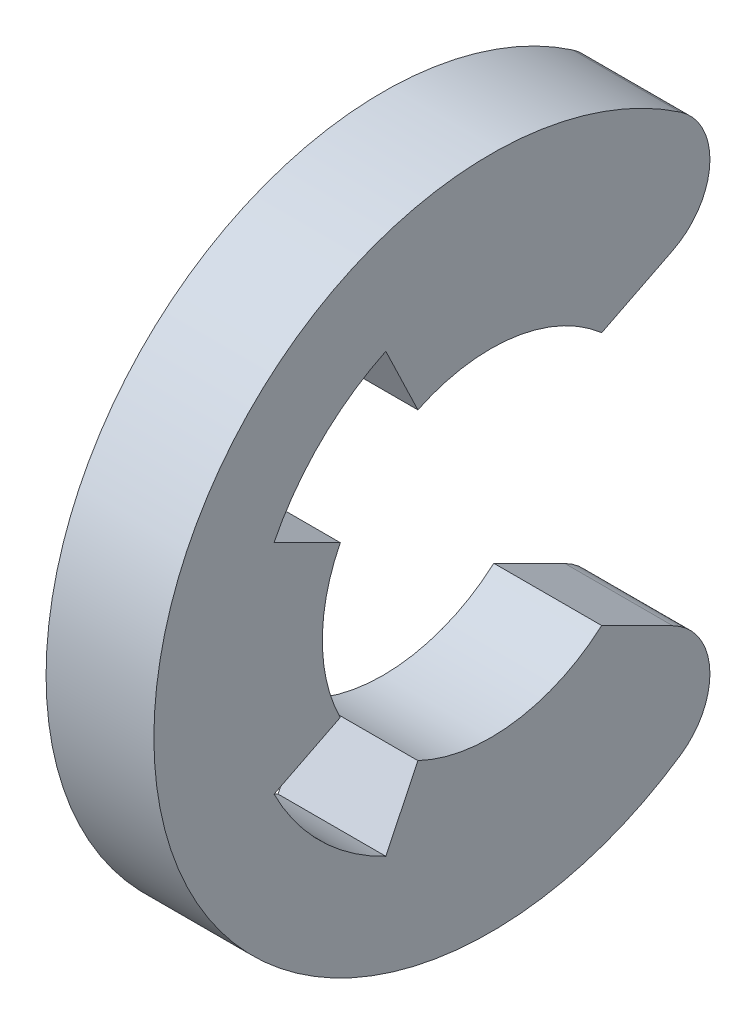
from build123d import *

# Parameters (mm, degrees)
EXTRUDE_1_DEPTH = 0.8
FILLET_1_R      = 0.5


with BuildPart() as part:
    # 草图1 → 凸台-拉伸1 (new body)
    with BuildSketch(Plane.YZ):
        with BuildLine():
            Line((-0.94087303, -0.822956828), (-1.523298061, -1.982312543))
            ThreePointArc((-1.523298061, -1.982312543), (0, 2.5), (1.523298061, -1.982312543))
            Line((1.523298061, -1.982312543), (0.94087303, -0.822956828))
            ThreePointArc((0.94087303, -0.822956828), (1.238528092, -0.16896202), (1.126927701, 0.540864084))
            Line((1.126927701, 0.540864084), (1.622775889, 0.778844281))
            ThreePointArc((1.622775889, 0.778844281), (1.284522021, 1.260953281), (0.808758974, 1.608076156))
            Line((0.808758974, 1.608076156), (0.561638176, 1.116719553))
            ThreePointArc((0.561638176, 1.116719553), (0, 1.25), (-0.561638176, 1.116719553))
            Line((-0.561638176, 1.116719553), (-0.808758974, 1.608076156))
            ThreePointArc((-0.808758974, 1.608076156), (-1.284522021, 1.260953281), (-1.622775889, 0.778844281))
            Line((-1.622775889, 0.778844281), (-1.126927701, 0.540864084))
            ThreePointArc((-1.126927701, 0.540864084), (-1.238528092, -0.16896202), (-0.94087303, -0.822956828))
        make_face()
    extrude(amount=EXTRUDE_1_DEPTH)

    # 圆角1
    fillet_1_edges = [part.edges().sort_by_distance(p)[0] for p in [
        (0.4, -1.523298061, -1.982312543),
        (0.4, 1.523298061, -1.982312543),
    ]]
    fillet(fillet_1_edges, radius=FILLET_1_R)


solid = part.part
